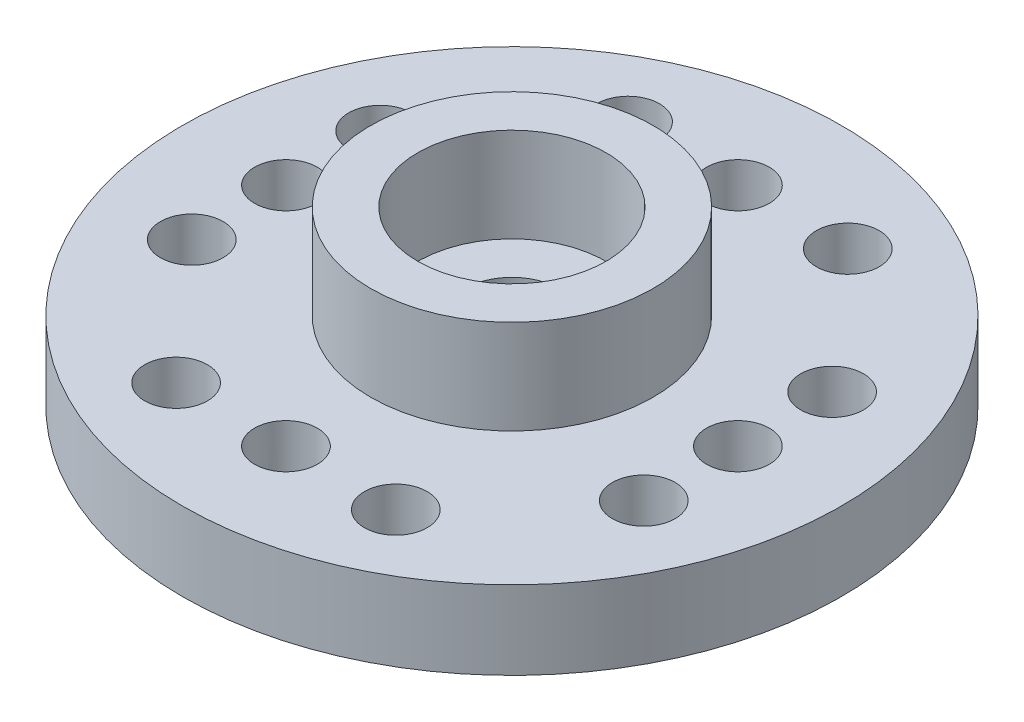
from build123d import *

# Parameters (mm, degrees)
CROQUIS1_R              = 10.5
SALIENTE_EXTRUIR1_DEPTH = 2.5
CROQUIS2_R              = 4.5
CROQUIS2_R_2            = 3
SALIENTE_EXTRUIR2_DEPTH = 3
CROQUIS4_R              = 4.75
CROQUIS4_R_2            = 3.25
CORTAR_EXTRUIR1_DEPTH   = 1
CROQUIS5_R              = 3
CORTAR_EXTRUIR2_DEPTH   = 1
CROQUIS6_R              = 1.5
CORTAR_EXTRUIR3_DEPTH   = 3
CROQUIS7_R              = 1
CORTAR_EXTRUIR4_DEPTH   = 3


with BuildPart() as part:
    # Croquis1 → Saliente-Extruir1 (new body)
    with BuildSketch(Plane(origin=(0, 0, 0), x_dir=(1, 0, 0), z_dir=(0, 1, 0))):
        with Locations(Location((0, 0, 0), (0, 0, 270))):
            Circle(CROQUIS1_R)
    extrude(amount=SALIENTE_EXTRUIR1_DEPTH)

    # Croquis2 → Saliente-Extruir2 (add)
    with BuildSketch(Plane(origin=(0, 2.5, 0), x_dir=(1, 0, 0), z_dir=(0, 1, 0))):
        with Locations(Location((0, 0, 0), (0, 0, 270))):
            Circle(CROQUIS2_R)
        with Locations(Location((0, 0, 0), (0, 0, 270))):
            Circle(CROQUIS2_R_2, mode=Mode.SUBTRACT)
    extrude(amount=SALIENTE_EXTRUIR2_DEPTH)

    # Croquis4 → Cortar-Extruir1 (cut)
    with BuildSketch(Plane.XZ):
        with Locations(Location((0, 0, 0), (0, 0, 270))):
            Circle(CROQUIS4_R)
        with Locations(Location((0, 0, 0), (0, 0, 270))):
            Circle(CROQUIS4_R_2, mode=Mode.SUBTRACT)
    extrude(amount=-CORTAR_EXTRUIR1_DEPTH, mode=Mode.SUBTRACT)

    # Croquis5 → Cortar-Extruir2 (cut)
    with BuildSketch(Plane.XZ):
        with Locations(Location((0, 0, 0), (0, 0, 90))):
            Circle(CROQUIS5_R)
    extrude(amount=-CORTAR_EXTRUIR2_DEPTH, mode=Mode.SUBTRACT)

    # Croquis6 → Cortar-Extruir3 (cut)
    with BuildSketch(Plane.XZ.offset(-1)):
        with Locations(Location((0, 0, 0), (0, 0, 270))):
            Circle(CROQUIS6_R)
    extrude(amount=-CORTAR_EXTRUIR3_DEPTH, mode=Mode.SUBTRACT)

    # Croquis7 → Cortar-Extruir4 (cut)
    with BuildSketch(Plane.XZ):
        with Locations(Location((0, 7.2, 0), (0, 0, 270))):
            Circle(CROQUIS7_R)
        with Locations(Location((0, -7.2, 0), (0, 0, 90))):
            Circle(CROQUIS7_R)
        with Locations(Location((7.2, 0, 0), (0, 0, 270))):
            Circle(CROQUIS7_R)
        with Locations(Location((-7.2, 0, 0), (0, 0, 90))):
            Circle(CROQUIS7_R)
        with Locations(Location((3.5, 7.2, 0), (0, 0, 270))):
            Circle(CROQUIS7_R)
        with Locations(Location((-3.5, 7.2, 0), (0, 0, 270))):
            Circle(CROQUIS7_R)
        with Locations(Location((3.5, -7.2, 0), (0, 0, 90))):
            Circle(CROQUIS7_R)
        with Locations(Location((-3.5, -7.2, 0), (0, 0, 90))):
            Circle(CROQUIS7_R)
        with Locations(Location((7.2, 3, 0), (0, 0, 270))):
            Circle(CROQUIS7_R)
        with Locations(Location((7.2, -3, 0), (0, 0, 270))):
            Circle(CROQUIS7_R)
        with Locations(Location((-7.2, -3, 0), (0, 0, 90))):
            Circle(CROQUIS7_R)
        with Locations(Location((-7.2, 3, 0), (0, 0, 90))):
            Circle(CROQUIS7_R)
    extrude(amount=-CORTAR_EXTRUIR4_DEPTH, mode=Mode.SUBTRACT)


solid = part.part
